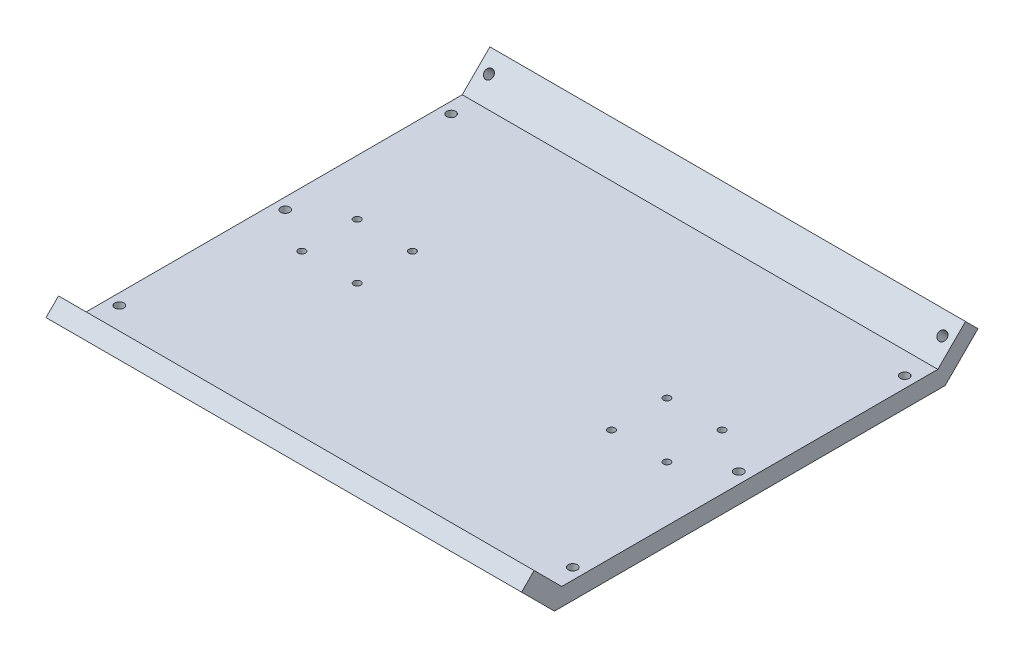
from build123d import *

# Parameters (mm, degrees)
MAIN_DEPTH                      = 107.5
F_4_0MM_DOWEL_HOLE1_D           = 4.1
F_4_0MM_DOWEL_HOLE1_ON_FACE_2_D = 4.1
F_4_0MM_DOWEL_HOLE1_ON_FACE_3_D = 4.1
F_4_0MM_DOWEL_HOLE1_ON_FACE_4_D = 4.1
SKETCH4_R                       = 1.6
ATTACHMENT_SCREW_HOLES_DEPTH    = 151.392275662


with BuildPart() as part:
    # Sketch2 → Main (new, symmetric)
    with BuildSketch(Plane(origin=(0, 0, 0), x_dir=(0, 0, -1), z_dir=(1, 0, 0))):
        Polygon((-85, 0), (85, 0), (97.5, 12.5), (103.156854249, 6.843145751), (88.313708499, -8), (-88.313708499, -8), (-103.156854249, 6.843145751), (-97.5, 12.5), align=None)
    extrude(amount=MAIN_DEPTH, both=True)

    # Ø4.0mm Dowel Hole1 (through all)
    with Locations(Plane(origin=(-102.5, 7.071067812, -92.071067812), x_dir=(0, 0.707106781187, -0.707106781187), z_dir=(0, 0.707106781187, 0.707106781187))):
        with Locations((0, 0)):
            Hole(F_4_0MM_DOWEL_HOLE1_D / 2)

    # Ø4.0mm Dowel Hole1 on face 2 (through all)
    with Locations(Plane(origin=(-102.5, 0, -75), x_dir=(0, 0, 1), z_dir=(0, 1, 0))):
        with Locations((0, 0), (75, 0), (150, 0), (150, 205), (75, 205), (0, 205)):
            Hole(F_4_0MM_DOWEL_HOLE1_ON_FACE_2_D / 2)

    # Ø4.0mm Dowel Hole1 on face 3 (through all)
    with Locations(Plane(origin=(-102.5, 7.071067812, 92.071067812), x_dir=(0, -0.707106781187, -0.707106781187), z_dir=(0, 0.707106781187, -0.707106781187))):
        with Locations((0, 0), (0, -205)):
            Hole(F_4_0MM_DOWEL_HOLE1_ON_FACE_3_D / 2)

    # Ø4.0mm Dowel Hole1 on face 4 (through all)
    with Locations(Plane(origin=(102.5, 7.071067812, -92.071067812), x_dir=(0, 0.707106781187, -0.707106781187), z_dir=(0, 0.707106781187, 0.707106781187))):
        with Locations((0, 0)):
            Hole(F_4_0MM_DOWEL_HOLE1_ON_FACE_4_D / 2)

    # Sketch4 → Attachment screw holes (cut, through all)
    with BuildSketch(Plane.XZ.offset(8)):
        with Locations(Location((57.5, 12.5, 0), (0, 0, 270))):
            Circle(SKETCH4_R)
        with Locations(Location((82.5, 12.5, 0), (0, 0, 270))):
            Circle(SKETCH4_R)
        with Locations(Location((82.5, -12.5, 0), (0, 0, 270))):
            Circle(SKETCH4_R)
        with Locations(Location((57.5, -12.5, 0), (0, 0, 270))):
            Circle(SKETCH4_R)
    attachment_screw_holes = extrude(amount=-ATTACHMENT_SCREW_HOLES_DEPTH, mode=Mode.SUBTRACT)

    # Mirror1: Attachment screw holes across plane
    add(attachment_screw_holes.mirror(Plane(origin=(0, 0, 0), x_dir=(0, 0, 1), z_dir=(1, 0, 0))), mode=Mode.SUBTRACT)


solid = part.part
